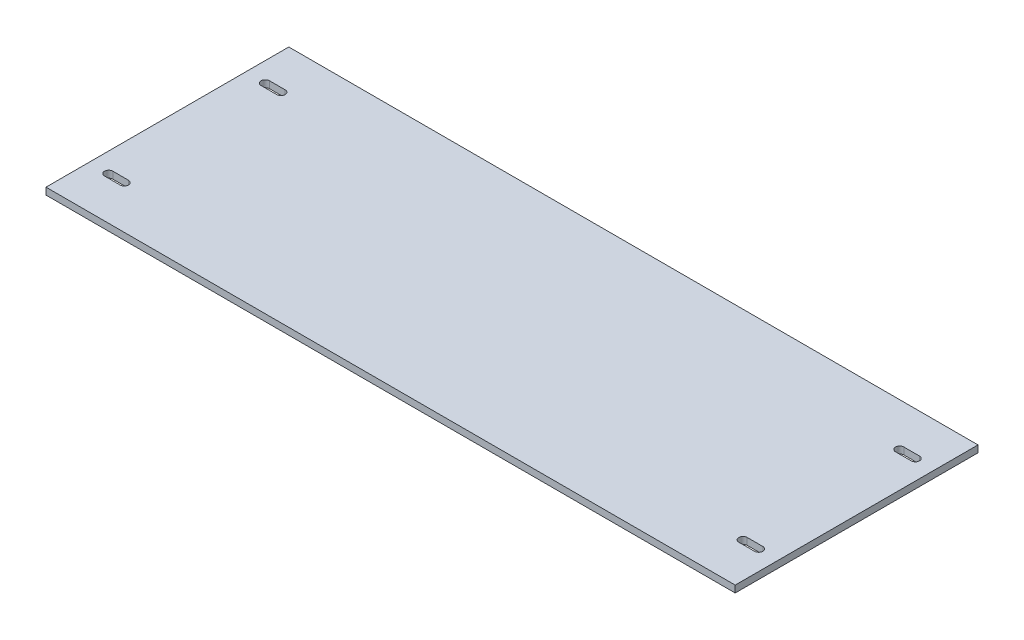
from build123d import *

# Parameters (mm, degrees)
SKETCH1_W           = 558.8
SKETCH1_H           = 196.85
BOSS_EXTRUDE1_DEPTH = 5.588


with BuildPart() as part:
    # Sketch1 → Boss-Extrude1 (new body)
    with BuildSketch(Plane(origin=(0, 0, 0), x_dir=(1, 0, 0), z_dir=(0, 1, 0))):
        with Locations((279.4, 98.425)):
            Rectangle(SKETCH1_W, SKETCH1_H)
        with BuildLine():
            Line((15.875, 38.3032), (28.575, 38.3032))
            ThreePointArc((28.575, 38.3032), (31.9532, 34.925), (28.575, 31.5468))
            Line((28.575, 31.5468), (15.875, 31.5468))
            ThreePointArc((15.875, 31.5468), (12.4968, 34.925), (15.875, 38.3032))
        make_face(mode=Mode.SUBTRACT)
        with BuildLine():
            Line((15.875, 165.3032), (28.575, 165.3032))
            ThreePointArc((28.575, 165.3032), (31.9532, 161.925), (28.575, 158.5468))
            Line((28.575, 158.5468), (15.875, 158.5468))
            ThreePointArc((15.875, 158.5468), (12.4968, 161.925), (15.875, 165.3032))
        make_face(mode=Mode.SUBTRACT)
        with BuildLine():
            Line((542.925, 158.5468), (530.225, 158.5468))
            ThreePointArc((530.225, 158.5468), (526.8468, 161.925), (530.225, 165.3032))
            Line((530.225, 165.3032), (542.925, 165.3032))
            ThreePointArc((542.925, 165.3032), (546.3032, 161.925), (542.925, 158.5468))
        make_face(mode=Mode.SUBTRACT)
        with BuildLine():
            Line((542.925, 31.5468), (530.225, 31.5468))
            ThreePointArc((530.225, 31.5468), (526.8468, 34.925), (530.225, 38.3032))
            Line((530.225, 38.3032), (542.925, 38.3032))
            ThreePointArc((542.925, 38.3032), (546.3032, 34.925), (542.925, 31.5468))
        make_face(mode=Mode.SUBTRACT)
    extrude(amount=BOSS_EXTRUDE1_DEPTH)


solid = part.part
